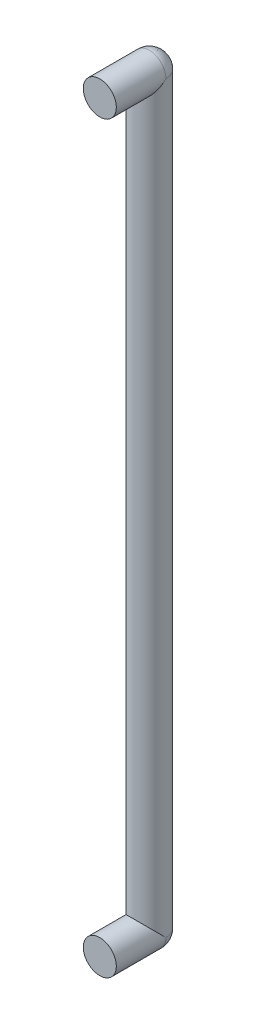
from build123d import *

# Parameters (mm, degrees)
SKETCH1_R           = 0.1
BOSS_EXTRUDE1_DEPTH = 4.5
SKETCH2_R           = 0.1
BOSS_EXTRUDE2_DEPTH = 0.3
REVOLVE1_ANGLE      = 90
REVOLVE2_ANGLE      = 90


with BuildPart() as part:
    # Sketch1 → Boss-Extrude1 (new body)
    with BuildSketch(Plane(origin=(0, 0, 0), x_dir=(1, 0, 0), z_dir=(0, 1, 0))):
        with Locations(Location((0, 0, 0), (0, 0, 270))):
            Circle(SKETCH1_R)
    extrude(amount=BOSS_EXTRUDE1_DEPTH)

    # Sketch2 → Boss-Extrude2 (add)
    with BuildSketch(Plane.XY):
        with Locations((0, 4.5)):
            Circle(SKETCH2_R)
        Circle(SKETCH2_R)
    extrude(amount=BOSS_EXTRUDE2_DEPTH)

    # Sketch5 → Revolve1 (revolve)
    with BuildSketch(Plane(origin=(0, 0, 0), x_dir=(-1, 0, 0), z_dir=(0, 0, -1))):
        with BuildLine():
            Line((-0.1, 4.5), (0.1, 4.5))
            ThreePointArc((0.1, 4.5), (0, 4.6), (-0.1, 4.5))
        make_face()
    revolve(axis=Axis((0.1, 4.5, 0), (-1, 0, 0)), revolution_arc=REVOLVE1_ANGLE)

    # Sketch6 → Revolve2 (revolve)
    with BuildSketch(Plane(origin=(0, 0, 0), x_dir=(-1, 0, 0), z_dir=(0, 0, -1))):
        with BuildLine():
            Line((-0.1, 0), (0.1, 0))
            ThreePointArc((0.1, 0), (0, -0.1), (-0.1, 0))
        make_face()
    revolve(axis=Axis((0.1, 0, 0), (1, 0, 0)), revolution_arc=REVOLVE2_ANGLE)


solid = part.part
